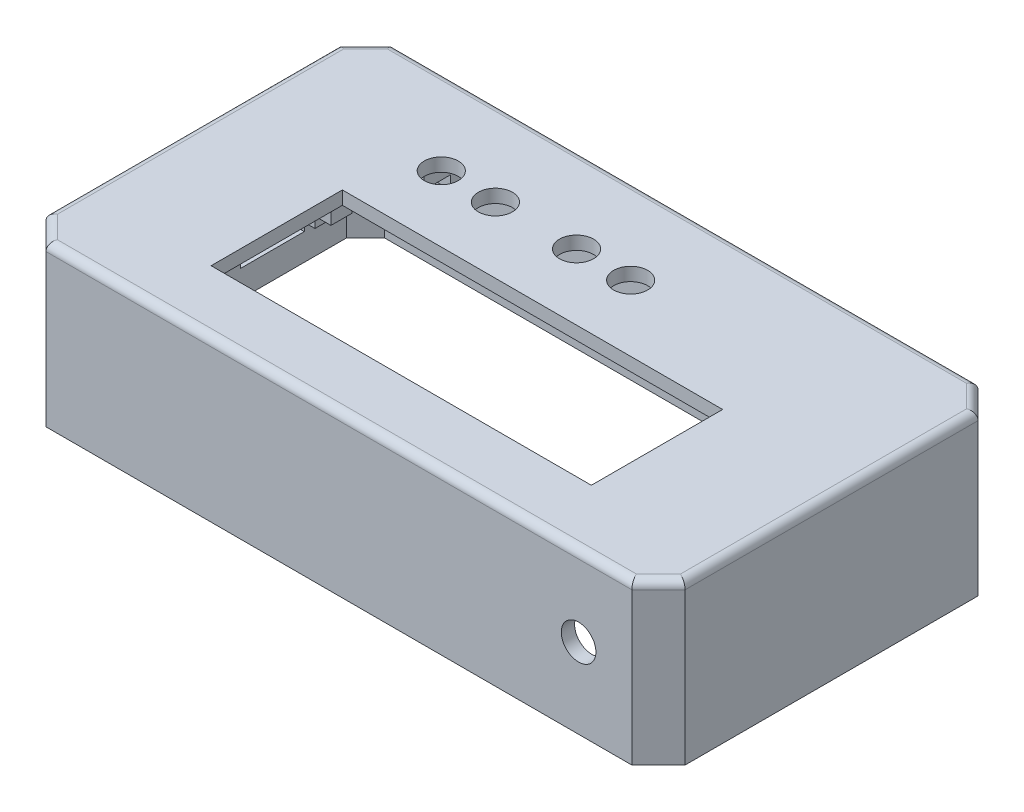
from build123d import *

# Parameters (mm, degrees)
SKETCH1_W               = 120
SKETCH1_H               = 65
BOSS_EXTRUDE1_DEPTH     = 30
CHAMFER1_SIZE           = 5
FILLET1_R               = 1.5
SHELL1_T                = -2.5
BOSS_EXTRUDE2_DEPTH     = 2
LPATTERN1_COUNT         = 2
LPATTERN1_PITCH         = 25
MIRROR1_COPY_1_DEPTH    = 2
BOSS_EXTRUDE3_DEPTH     = 2
BOSS_EXTRUDE4_DEPTH     = 2
CUT_EXTRUDE1_REACH      = 129.892
SKETCH7_R               = 6
SKETCH7_W               = 12
SKETCH7_H               = 8
CUT_EXTRUDE3_DEPTH      = 94.407708461
CUT_EXTRUDE3_DEPTH_BACK = 10
SKETCH9_R               = 3.25
CUT_EXTRUDE4_DEPTH      = 10
SKETCH6_R               = 3.2
SKETCH6_W               = 71.4
SKETCH6_H               = 24.65
CUT_EXTRUDE5_DEPTH      = 10


with BuildPart() as part:
    # Sketch1 → Boss-Extrude1 (new body)
    with BuildSketch(Plane(origin=(0, 0, 0), x_dir=(1, 0, 0), z_dir=(0, 1, 0))):
        Rectangle(SKETCH1_W, SKETCH1_H)
    extrude(amount=BOSS_EXTRUDE1_DEPTH)

    # Chamfer1
    chamfer1_edges = [part.edges().sort_by_distance(p)[0] for p in [
        (-60, 15, -32.5),
        (60, 15, -32.5),
        (60, 15, 32.5),
        (-60, 15, 32.5),
    ]]
    chamfer(chamfer1_edges, length=CHAMFER1_SIZE)

    # Fillet1
    fillet1_edges = [part.edges().sort_by_distance(p)[0] for p in [
        (0, 30, -32.5),
        (60, 30, 0),
        (-60, 30, 0),
        (0, 30, 32.5),
        (-57.5, 30, 30),
        (57.5, 30, 30),
        (-57.5, 30, -30),
        (57.5, 30, -30),
    ]]
    fillet(fillet1_edges, radius=FILLET1_R)

    # Shell1
    shell1_openings = [part.faces().sort_by_distance(p)[0] for p in [
        (0, 0, 0),
    ]]
    offset(amount=SHELL1_T, openings=shell1_openings, kind=Kind.INTERSECTION)

    # Sketch2 → Boss-Extrude2 (add, symmetric)
    with BuildSketch(Plane.XY.offset(20)):
        Polygon((47, 27.5), (47, 22), (40, 22), (40, 24), (37, 24), (37, 27.5), align=None)
    boss_extrude2 = extrude(amount=BOSS_EXTRUDE2_DEPTH, both=True)

    # LPattern1: Boss-Extrude2 ×2
    with Locations(*[(0, 0, -i * LPATTERN1_PITCH) for i in range(1, LPATTERN1_COUNT)]):
        add(boss_extrude2)

    # Mirror1: Boss-Extrude2 across plane
    add(boss_extrude2.mirror(Plane(origin=(0, 0, 0), x_dir=(0, 0, 1), z_dir=(1, 0, 0))))

    # Mirror1 copy 1 sketch → Mirror1 copy 1 (add, symmetric)
    with BuildSketch(Plane(origin=(0, 0, -5), x_dir=(-1, 0, 0), z_dir=(0, 0, 1))):
        Polygon((47, -27.5), (47, -22), (40, -22), (40, -24), (37, -24), (37, -27.5), align=None)
    extrude(amount=MIRROR1_COPY_1_DEPTH, both=True)

    # Sketch3 → Boss-Extrude3 (add, symmetric)
    with BuildSketch(Plane(origin=(32, 0, 0), x_dir=(0, 0, -1), z_dir=(1, 0, 0))):
        Polygon((17, 27.5), (17, 22), (10, 22), (10, 24), (7, 24), (7, 27.5), align=None)
        Polygon((-23, 27.5), (-30, 27.5), (-30, 22), (-26, 22), (-26, 24), (-23, 24), align=None)
    extrude(amount=BOSS_EXTRUDE3_DEPTH, both=True)

    # Sketch5 → Boss-Extrude4 (add, symmetric)
    with BuildSketch(Plane(origin=(-39.76, 0, 0), x_dir=(0, 0, -1), z_dir=(1, 0, 0))):
        Polygon((21.24, 27.5), (21.24, 20.25), (26.24, 20.25), (26.24, 17.75), (30, 17.75), (30, 27.5), align=None)
    extrude(amount=BOSS_EXTRUDE4_DEPTH, both=True)

    # Sketch7 → Cut-Extrude1 (cut, up to next)
    with BuildSketch(Plane.ZY.offset(60), mode=Mode.PRIVATE) as cut_extrude1_sk1:
        with Locations((19.3022, 14)):
            Circle(SKETCH7_R)
    cut_extrude1_tool1 = extrude(cut_extrude1_sk1.sketch, amount=-CUT_EXTRUDE1_REACH, mode=Mode.PRIVATE) & part.part
    # Sketch7 → Cut-Extrude1 (cut, up to next)
    with BuildSketch(Plane.ZY.offset(60), mode=Mode.PRIVATE) as cut_extrude1_sk2:
        with Locations((-12.5, 9)):
            Rectangle(SKETCH7_W, SKETCH7_H)
    cut_extrude1_tool2 = extrude(cut_extrude1_sk2.sketch, amount=-CUT_EXTRUDE1_REACH, mode=Mode.PRIVATE) & part.part
    add(cut_extrude1_tool1.solids().sort_by_distance((-60, 14, 19.3022))[0], mode=Mode.SUBTRACT)
    add(cut_extrude1_tool2.solids().sort_by_distance((-60, 9, -12.5))[0], mode=Mode.SUBTRACT)

    # Sketch8 → Cut-Extrude3 (cut, two sides: drawn at the far end of the back side and taken through both)
    with BuildSketch(Plane(origin=(0, 0, -32.5), x_dir=(-1, 0, 0), z_dir=(0, 0, -1)).offset(-CUT_EXTRUDE3_DEPTH_BACK)):
        with BuildLine():
            Line((-42, -234.178500307), (-42, 0))
            Line((-42, 0), (-42, 6))
            ThreePointArc((-42, 6), (-45, 9), (-48, 6))
            Line((-48, 6), (-48, 0))
            Line((-48, 0), (-48, -234.178500307))
            Line((-48, -234.178500307), (-48, -702.535500922))
            Line((-48, -702.535500922), (-42, -702.535500922))
            Line((-42, -702.535500922), (-42, -234.178500307))
        make_face()
    extrude(amount=CUT_EXTRUDE3_DEPTH + CUT_EXTRUDE3_DEPTH_BACK, mode=Mode.SUBTRACT)

    # Sketch9 → Cut-Extrude4 (cut)
    with BuildSketch(Plane.XY.offset(32.5)):
        with Locations((45, 15)):
            Circle(SKETCH9_R)
    extrude(amount=-CUT_EXTRUDE4_DEPTH, mode=Mode.SUBTRACT)

    # Sketch6 → Cut-Extrude5 (cut)
    with BuildSketch(Plane(origin=(0, 30, 0), x_dir=(1, 0, 0), z_dir=(0, 1, 0))):
        with Locations(Location((-29.52, 16.24, 0), (0, 0, 270))):
            Circle(SKETCH6_R)
        with Locations(Location((-19.36, 16.24, 0), (0, 0, 270))):
            Circle(SKETCH6_R)
        with Locations(Location((-4.12, 16.24, 0), (0, 0, 270))):
            Circle(SKETCH6_R)
        with Locations(Location((6.04, 16.24, 0), (0, 0, 270))):
            Circle(SKETCH6_R)
        with Locations((0, -8.475)):
            Rectangle(SKETCH6_W, SKETCH6_H)
    extrude(amount=-CUT_EXTRUDE5_DEPTH, mode=Mode.SUBTRACT)


solid = part.part
